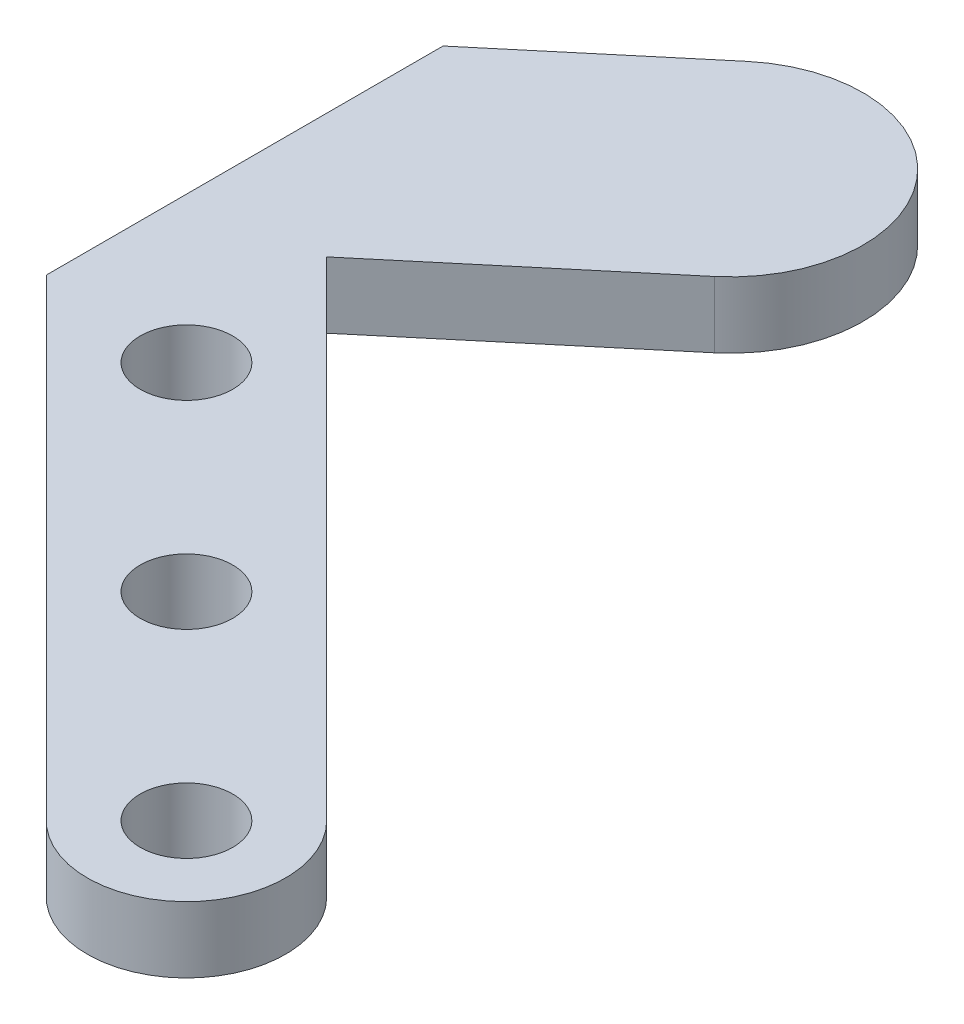
from build123d import *

# Parameters (mm, degrees)
SKETCH1_R           = 7
BOSS_EXTRUDE1_DEPTH = 10


with BuildPart() as part:
    # Sketch1 → Boss-Extrude1 (new body)
    with BuildSketch(Plane(origin=(0, 0, 0), x_dir=(1, 0, 0), z_dir=(0, 1, 0))):
        with BuildLine():
            Line((-42.331013445, 0), (-10.444849334, 26.755668546))
            ThreePointArc((-10.444849334, 26.755668546), (-7.979712665, 54.932309602), (-36.156353721, 57.39744627))
            Line((-36.156353721, 57.39744627), (-61.156353721, 36.419955491))
            Line((-61.156353721, 36.419955491), (-61.156353721, -23.580044509))
            Line((-61.156353721, -23.580044509), (9.843646279, -94.580044509))
            ThreePointArc((9.843646279, -94.580044509), (31.279693612, -95.296110549), (31.518421727, -73.849435172))
            Line((31.518421727, -73.849435172), (-42.331013445, 0))
        make_face()
        with Locations(Location((20.911820009, -84.456036889, 0), (0, 0, 270))):
            Circle(SKETCH1_R, mode=Mode.SUBTRACT)
        with Locations(Location((-9.088179991, -54.456036889, 0), (0, 0, 270))):
            Circle(SKETCH1_R, mode=Mode.SUBTRACT)
        with Locations(Location((-39.088179991, -24.456036889, 0), (0, 0, 270))):
            Circle(SKETCH1_R, mode=Mode.SUBTRACT)
    extrude(amount=BOSS_EXTRUDE1_DEPTH)


solid = part.part
